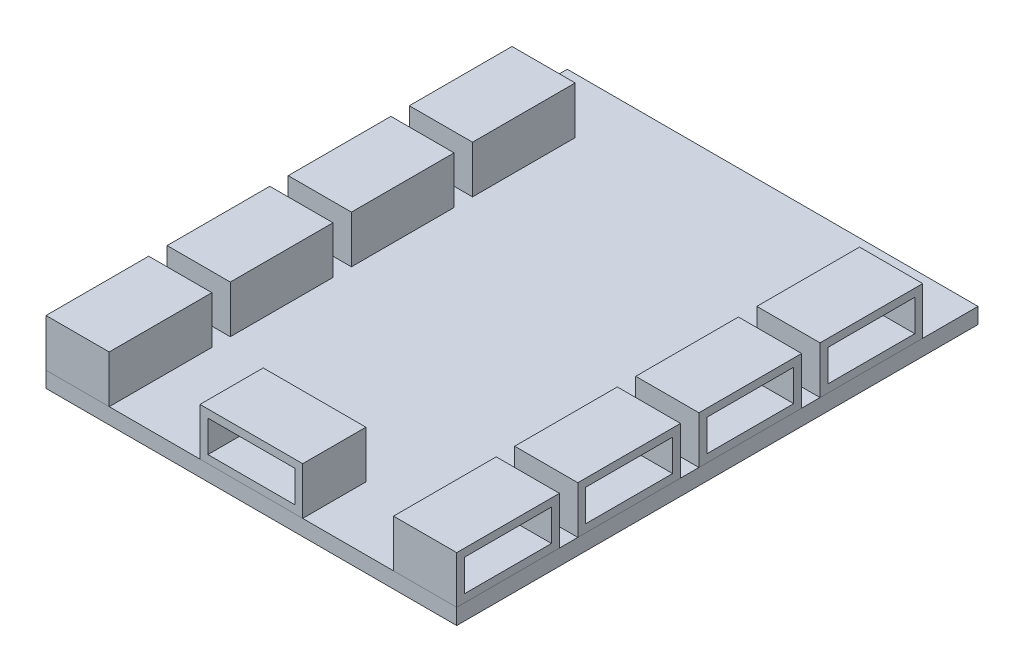
from build123d import *

# Parameters (mm, degrees)
SKETCH1_W             = 26
SKETCH1_H             = 33
BOSS_EXTRUDE1_DEPTH   = 1
SKETCH2_W             = 4
SKETCH2_H             = 6.5
BOSS_EXTRUDE2_DEPTH   = 3
BOSS_EXTRUDE2_2_DEPTH = 3
BOSS_EXTRUDE2_3_DEPTH = 3
BOSS_EXTRUDE2_4_DEPTH = 3
BOSS_EXTRUDE2_5_DEPTH = 3
BOSS_EXTRUDE2_6_DEPTH = 3
BOSS_EXTRUDE2_7_DEPTH = 3
BOSS_EXTRUDE2_8_DEPTH = 3
SKETCH3_W             = 5.5
SKETCH3_H             = 2
CUT_EXTRUDE1_DEPTH    = 3.5
SKETCH4_W             = 6.5
SKETCH4_H             = 3
BOSS_EXTRUDE3_DEPTH   = 4
SKETCH5_W             = 5.5
SKETCH5_H             = 2
CUT_EXTRUDE2_DEPTH    = 3.5


with BuildPart() as part:
    # Sketch1 → Boss-Extrude1 (new body)
    with BuildSketch(Plane(origin=(0, 0, 0), x_dir=(1, 0, 0), z_dir=(0, 1, 0))):
        Rectangle(SKETCH1_W, SKETCH1_H)
    extrude(amount=BOSS_EXTRUDE1_DEPTH)


with BuildPart() as body_2:
    # Sketch2 → Boss-Extrude2 (new body)
    with BuildSketch(Plane(origin=(0, 1, 0), x_dir=(1, 0, 0), z_dir=(0, 1, 0))):
        with Locations((11, 9.75)):
            Rectangle(SKETCH2_W, SKETCH2_H)
    extrude(amount=BOSS_EXTRUDE2_DEPTH)


with BuildPart() as body_3:
    # Sketch2 → Boss-Extrude2 2 (new body)
    with BuildSketch(Plane(origin=(0, 1, 0), x_dir=(1, 0, 0), z_dir=(0, 1, 0))):
        with Locations((11, 2.083333333)):
            Rectangle(SKETCH2_W, SKETCH2_H)
    extrude(amount=BOSS_EXTRUDE2_2_DEPTH)


with BuildPart() as body_4:
    # Sketch2 → Boss-Extrude2 3 (new body)
    with BuildSketch(Plane(origin=(0, 1, 0), x_dir=(1, 0, 0), z_dir=(0, 1, 0))):
        with Locations((11, -5.583333333)):
            Rectangle(SKETCH2_W, SKETCH2_H)
    extrude(amount=BOSS_EXTRUDE2_3_DEPTH)


with BuildPart() as body_5:
    # Sketch2 → Boss-Extrude2 4 (new body)
    with BuildSketch(Plane(origin=(0, 1, 0), x_dir=(1, 0, 0), z_dir=(0, 1, 0))):
        with Locations((11, -13.25)):
            Rectangle(SKETCH2_W, SKETCH2_H)
    extrude(amount=BOSS_EXTRUDE2_4_DEPTH)


with BuildPart() as body_6:
    # Sketch2 → Boss-Extrude2 5 (new body)
    with BuildSketch(Plane(origin=(0, 1, 0), x_dir=(1, 0, 0), z_dir=(0, 1, 0))):
        with Locations((-11, -13.25)):
            Rectangle(SKETCH2_W, SKETCH2_H)
    extrude(amount=BOSS_EXTRUDE2_5_DEPTH)


with BuildPart() as body_7:
    # Sketch2 → Boss-Extrude2 6 (new body)
    with BuildSketch(Plane(origin=(0, 1, 0), x_dir=(1, 0, 0), z_dir=(0, 1, 0))):
        with Locations((-11, -5.583333333)):
            Rectangle(SKETCH2_W, SKETCH2_H)
    extrude(amount=BOSS_EXTRUDE2_6_DEPTH)


with BuildPart() as body_8:
    # Sketch2 → Boss-Extrude2 7 (new body)
    with BuildSketch(Plane(origin=(0, 1, 0), x_dir=(1, 0, 0), z_dir=(0, 1, 0))):
        with Locations((-11, 2.083333333)):
            Rectangle(SKETCH2_W, SKETCH2_H)
    extrude(amount=BOSS_EXTRUDE2_7_DEPTH)


with BuildPart() as body_9:
    # Sketch2 → Boss-Extrude2 8 (new body)
    with BuildSketch(Plane(origin=(0, 1, 0), x_dir=(1, 0, 0), z_dir=(0, 1, 0))):
        with Locations((-11, 9.75)):
            Rectangle(SKETCH2_W, SKETCH2_H)
    extrude(amount=BOSS_EXTRUDE2_8_DEPTH)


with BuildPart() as cut_extrude1_tool:
    # Sketch3 → Cut-Extrude1 (new body)
    with BuildSketch(Plane(origin=(13, 0, 0), x_dir=(0, 0, -1), z_dir=(1, 0, 0))):
        with Locations((2.083333333, 2.5)):
            Rectangle(SKETCH3_W, SKETCH3_H)
        with Locations((9.75, 2.5)):
            Rectangle(SKETCH3_W, SKETCH3_H)
        with Locations((-5.583333333, 2.5)):
            Rectangle(SKETCH3_W, SKETCH3_H)
        with Locations((-13.25, 2.5)):
            Rectangle(SKETCH3_W, SKETCH3_H)
    cut_extrude1 = extrude(amount=-CUT_EXTRUDE1_DEPTH)


with BuildPart() as body_2_1:
    add(body_2.part)

    # Cut-Extrude1: cut by cut_extrude1_tool
    add(cut_extrude1_tool.part, mode=Mode.SUBTRACT)


with BuildPart() as body_3_1:
    add(body_3.part)

    # Cut-Extrude1: cut by cut_extrude1_tool
    add(cut_extrude1_tool.part, mode=Mode.SUBTRACT)


with BuildPart() as body_4_1:
    add(body_4.part)

    # Cut-Extrude1: cut by cut_extrude1_tool
    add(cut_extrude1_tool.part, mode=Mode.SUBTRACT)


with BuildPart() as body_5_1:
    add(body_5.part)

    # Cut-Extrude1: cut by cut_extrude1_tool
    add(cut_extrude1_tool.part, mode=Mode.SUBTRACT)


with BuildPart() as mirror1_tool:
    # Mirror1: Cut-Extrude1 across plane
    add(cut_extrude1.mirror(Plane(origin=(0, 0, 0), x_dir=(0, 0, 1), z_dir=(1, 0, 0))))


with BuildPart() as body_6_1:
    add(body_6.part)

    # Mirror1: cut by mirror1_tool
    add(mirror1_tool.part, mode=Mode.SUBTRACT)


with BuildPart() as body_7_1:
    add(body_7.part)

    # Mirror1: cut by mirror1_tool
    add(mirror1_tool.part, mode=Mode.SUBTRACT)


with BuildPart() as body_8_1:
    add(body_8.part)

    # Mirror1: cut by mirror1_tool
    add(mirror1_tool.part, mode=Mode.SUBTRACT)


with BuildPart() as body_9_1:
    add(body_9.part)

    # Mirror1: cut by mirror1_tool
    add(mirror1_tool.part, mode=Mode.SUBTRACT)


with BuildPart() as body_10:
    # Sketch4 → Boss-Extrude3 (new body)
    with BuildSketch(Plane.XY.offset(16.5)):
        with Locations((0, 2.5)):
            Rectangle(SKETCH4_W, SKETCH4_H)
    extrude(amount=-BOSS_EXTRUDE3_DEPTH)

    # Sketch5 → Cut-Extrude2 (cut)
    with BuildSketch(Plane.XY.offset(16.5)):
        with Locations((0, 2.5)):
            Rectangle(SKETCH5_W, SKETCH5_H)
    extrude(amount=-CUT_EXTRUDE2_DEPTH, mode=Mode.SUBTRACT)


solid = Compound([part.part, body_2_1.part, body_3_1.part, body_4_1.part, body_5_1.part, body_6_1.part, body_7_1.part, body_8_1.part, body_9_1.part, body_10.part])
